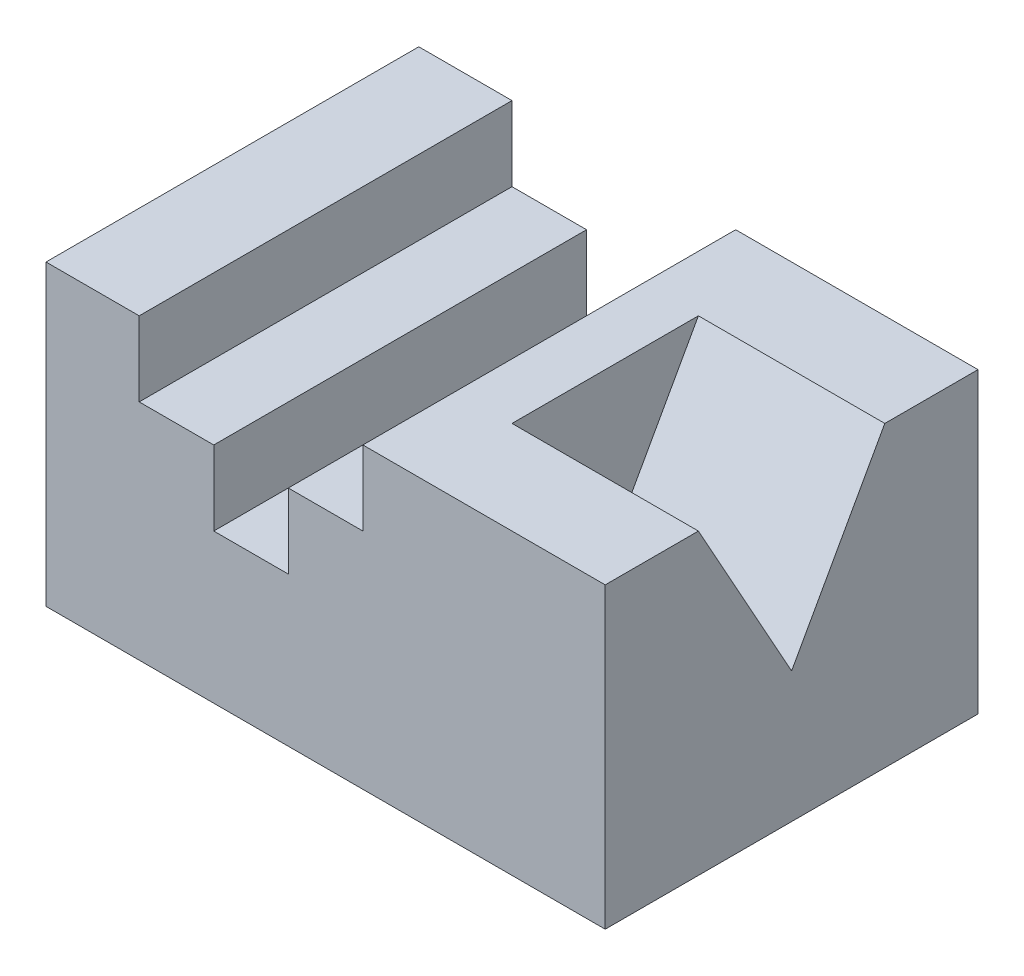
from build123d import *

# Parameters (mm, degrees)
BOSS_EXTRUDE1_DEPTH = 50
CUT_EXTRUDE1_START  = 150
CUT_EXTRUDE1_DEPTH  = 50


with BuildPart() as part:
    # Sketch1 → Boss-Extrude1 (new, symmetric)
    with BuildSketch(Plane.XY):
        Polygon((0, 0), (0, 80), (25, 80), (25, 60), (45, 60), (45, 40), (65, 40), (65, 60), (85, 60), (85, 80), (150, 80), (150, 0), align=None)
    extrude(amount=BOSS_EXTRUDE1_DEPTH, both=True)

    # Sketch2 → Cut-Extrude1 (cut)
    with BuildSketch(Plane(origin=(0, 0, 0), x_dir=(0, 0, -1), z_dir=(1, 0, 0)).offset(CUT_EXTRUDE1_START)):
        Polygon((-25, 80), (25, 80), (0, 35), align=None)
    extrude(amount=-CUT_EXTRUDE1_DEPTH, mode=Mode.SUBTRACT)


solid = part.part
